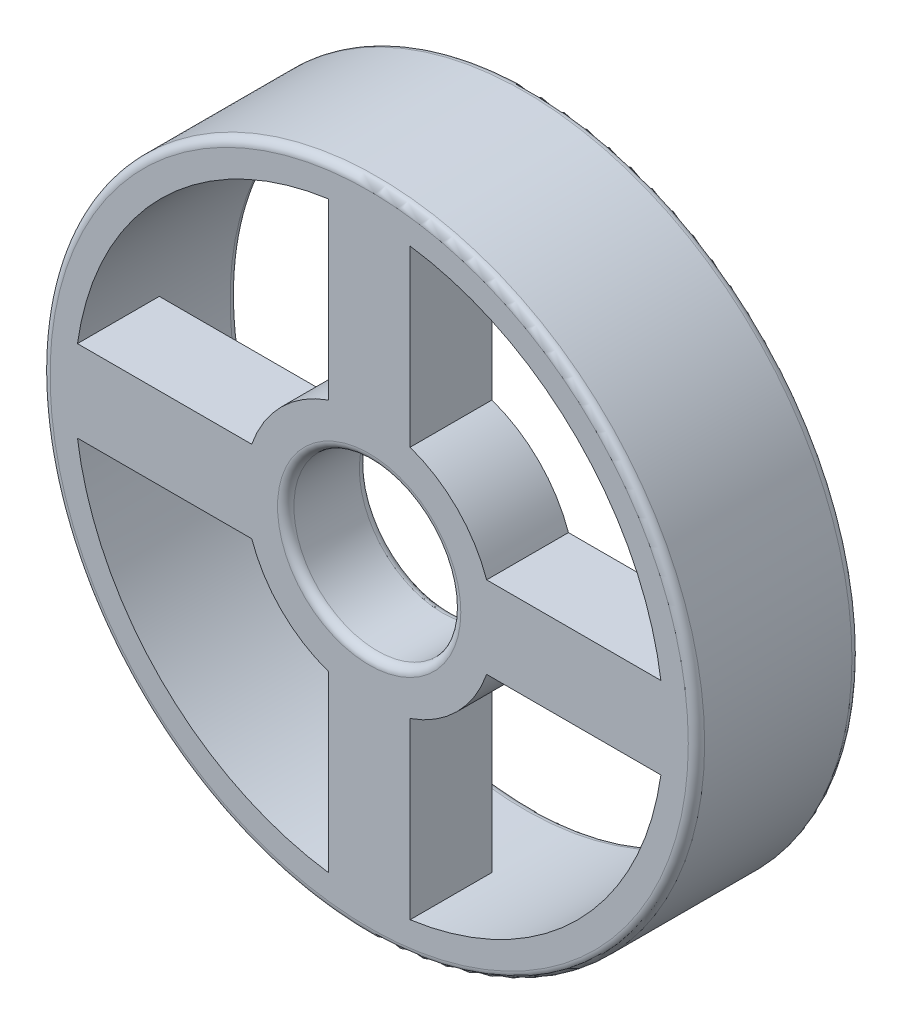
from build123d import *

# Parameters (mm, degrees)
SKETCH2_R           = 20
BOSS_EXTRUDE1_DEPTH = 10
SKETCH4_R           = 5.1
CUT_EXTRUDE1_DEPTH  = 31
CUT_EXTRUDE2_START  = -5
SKETCH5_R           = 18
CUT_EXTRUDE2_DEPTH  = 5
FILLET1_R           = 0.5


with BuildPart() as part:
    # Sketch2 → Boss-Extrude1 (new body)
    with BuildSketch(Plane.XY):
        Circle(SKETCH2_R)
    extrude(amount=BOSS_EXTRUDE1_DEPTH)

    # Sketch4 → Cut-Extrude1 (cut, through all)
    with BuildSketch(Plane.XY.offset(10)):
        Circle(SKETCH4_R)
        with BuildLine():
            Line((-2.5, 17.82554347), (-2.5, 7.177046746))
            ThreePointArc((-2.5, 7.177046746), (-5.374011537, 5.374011537), (-7.177046746, 2.5))
            Line((-7.177046746, 2.5), (-17.82554347, 2.5))
            ThreePointArc((-17.82554347, 2.5), (-12.727922061, 12.727922061), (-2.5, 17.82554347))
        make_face()
        with BuildLine():
            Line((2.5, 17.82554347), (2.5, 7.177046746))
            ThreePointArc((2.5, 7.177046746), (5.374011537, 5.374011537), (7.177046746, 2.5))
            Line((7.177046746, 2.5), (17.82554347, 2.5))
            ThreePointArc((17.82554347, 2.5), (12.727922061, 12.727922061), (2.5, 17.82554347))
        make_face()
        with BuildLine():
            Line((7.177046746, -2.5), (17.82554347, -2.5))
            ThreePointArc((17.82554347, -2.5), (12.727922061, -12.727922061), (2.5, -17.82554347))
            Line((2.5, -17.82554347), (2.5, -7.177046746))
            ThreePointArc((2.5, -7.177046746), (5.374011537, -5.374011537), (7.177046746, -2.5))
        make_face()
        with BuildLine():
            Line((-7.177046746, -2.5), (-17.82554347, -2.5))
            ThreePointArc((-17.82554347, -2.5), (-12.727922061, -12.727922061), (-2.5, -17.82554347))
            Line((-2.5, -17.82554347), (-2.5, -7.177046746))
            ThreePointArc((-2.5, -7.177046746), (-5.374011537, -5.374011537), (-7.177046746, -2.5))
        make_face()
    extrude(amount=-CUT_EXTRUDE1_DEPTH, mode=Mode.SUBTRACT)

    # Sketch5 → Cut-Extrude2 (cut)
    with BuildSketch(Plane(origin=(0, 0, 0), x_dir=(-1, 0, 0), z_dir=(0, 0, -1)).offset(CUT_EXTRUDE2_START)):
        with Locations(Location((0, 0, 0), (0, 0, 172.016443854))):
            Circle(SKETCH5_R)
    extrude(amount=CUT_EXTRUDE2_DEPTH, mode=Mode.SUBTRACT)

    # Fillet1
    fillet1_edges = [part.edges().sort_by_distance(p)[0] for p in [
        (-20, 0, 0),
        (-18, 0, 0),
        (-5.1, 0, 10),
        (-20, 0, 10),
        (-5.1, 0, 5),
    ]]
    fillet(fillet1_edges, radius=FILLET1_R)


solid = part.part
